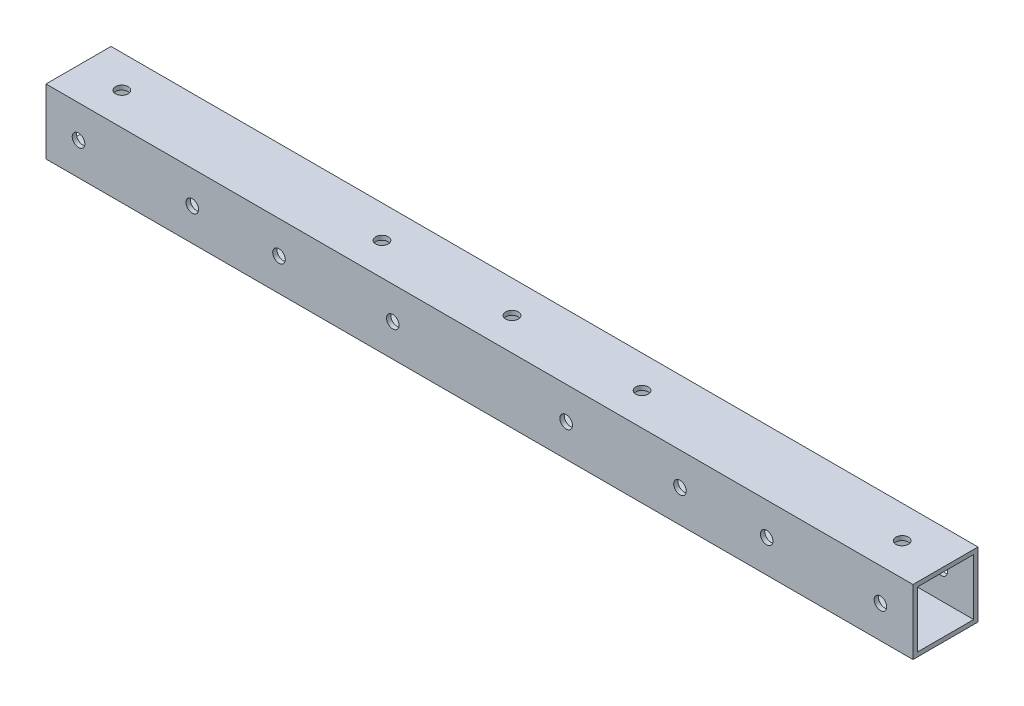
from build123d import *

# Parameters (mm, degrees)
SKETCH_11_W         = 15
SKETCH_11_H         = 15
SKETCH_11_W_2       = 13
SKETCH_11_H_2       = 13
F_15X15X1_1_DEPTH   = 200
SKETCH_12_R         = 1.45
CUT_EXTRUDE_2_DEPTH = 201.701893364
SKETCH_13_R         = 1.45
CUT_EXTRUDE_3_DEPTH = 201.701893364
SKETCH_14_R         = 1.45
CUT_EXTRUDE_4_DEPTH = 201.701893364
SKETCH_15_R         = 1.45
CUT_EXTRUDE_5_DEPTH = 201.701893364


with BuildPart() as part:
    # 草图11 → 铝管 15X15X1(1) (new body)
    with BuildSketch(Plane(origin=(0, 0, 0), x_dir=(0, 0, -1), z_dir=(1, 0, 0))):
        Rectangle(SKETCH_11_W, SKETCH_11_H)
        Rectangle(SKETCH_11_W_2, SKETCH_11_H_2, mode=Mode.SUBTRACT)
    extrude(amount=F_15X15X1_1_DEPTH)

    # 草图12 → 切除-拉伸2 (cut, through all)
    with BuildSketch(Plane(origin=(0, 7.5, 0), x_dir=(-1, 0, 0), z_dir=(0, -1, 0))):
        with Locations(Location((-100, 0, 0), (0, 0, 90))):
            Circle(SKETCH_12_R)
        with Locations(Location((-190, 0, 0), (0, 0, 90))):
            Circle(SKETCH_12_R)
        with Locations(Location((-10, 0, 0), (0, 0, 90))):
            Circle(SKETCH_12_R)
    extrude(amount=CUT_EXTRUDE_2_DEPTH, mode=Mode.SUBTRACT)

    # 草图13 → 切除-拉伸3 (cut, through all)
    with BuildSketch(Plane.XY.offset(7.5)):
        with Locations((7.5, 0)):
            Circle(SKETCH_13_R)
        with Locations((33.75, 0)):
            Circle(SKETCH_13_R)
        with Locations((53.75, 0)):
            Circle(SKETCH_13_R)
        with Locations(Location((146.25, 0, 0), (0, 0, 180))):
            Circle(SKETCH_13_R)
        with Locations(Location((166.25, 0, 0), (0, 0, 180))):
            Circle(SKETCH_13_R)
        with Locations(Location((192.5, 0, 0), (0, 0, 180))):
            Circle(SKETCH_13_R)
    extrude(amount=-CUT_EXTRUDE_3_DEPTH, mode=Mode.SUBTRACT)

    # 草图14 → 切除-拉伸4 (cut, through all)
    with BuildSketch(Plane.XY.offset(7.5)):
        with Locations((80, 0)):
            Circle(SKETCH_14_R)
        with Locations((120, 0)):
            Circle(SKETCH_14_R)
    extrude(amount=-CUT_EXTRUDE_4_DEPTH, mode=Mode.SUBTRACT)

    # 草图15 → 切除-拉伸5 (cut, through all)
    with BuildSketch(Plane(origin=(0, 7.5, 0), x_dir=(1, 0, 0), z_dir=(0, 1, 0))):
        with Locations(Location((70, 0, 0), (0, 0, 270))):
            Circle(SKETCH_15_R)
        with Locations(Location((130, 0, 0), (0, 0, 270))):
            Circle(SKETCH_15_R)
    extrude(amount=-CUT_EXTRUDE_5_DEPTH, mode=Mode.SUBTRACT)


solid = part.part
